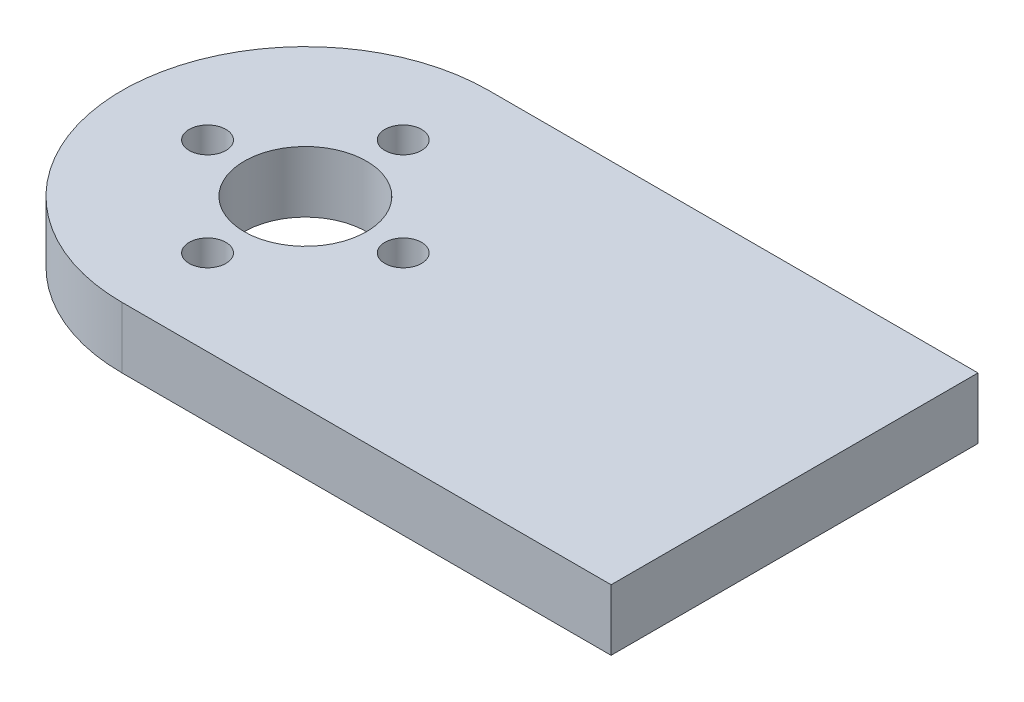
from build123d import *

# Parameters (mm, degrees)
BOSS_EXTRUDE1_DEPTH = 5


with BuildPart() as part:
    # Sketch1 → Boss-Extrude1 (new body)
    with BuildSketch(Plane(origin=(0, 0, 0), x_dir=(1, 0, 0), z_dir=(0, 1, 0))):
        with BuildLine():
            ThreePointArc((-7.859375, 1.493393655), (-5.656854249, 5.656854249), (-1.493393655, 7.859375))
            ThreePointArc((-1.493393655, 7.859375), (-1.109264959, 9.009718401), (0, 9.5))
            Line((0, 9.5), (0, 15))
            ThreePointArc((0, 15), (-15, 0), (0, -15))
            Line((0, -15), (0, -9.5))
            ThreePointArc((0, -9.5), (-1.109264959, -9.009718401), (-1.493393655, -7.859375))
            ThreePointArc((-1.493393655, -7.859375), (-5.656854249, -5.656854249), (-7.859375, -1.493393655))
            ThreePointArc((-7.859375, -1.493393655), (-9.5, 0), (-7.859375, 1.493393655))
        make_face()
        with BuildLine():
            ThreePointArc((1.5, 8), (1.498347504, 7.929609954), (1.493393655, 7.859375))
            ThreePointArc((1.493393655, 7.859375), (5.656854249, 5.656854249), (7.859375, 1.493393655))
            ThreePointArc((7.859375, 1.493393655), (9.009718401, 1.109264959), (9.5, 0))
            ThreePointArc((9.5, 0), (9.009718401, -1.109264959), (7.859375, -1.493393655))
            ThreePointArc((7.859375, -1.493393655), (5.656854249, -5.656854249), (1.493393655, -7.859375))
            ThreePointArc((1.493393655, -7.859375), (1.498347504, -7.929609954), (1.5, -8))
            ThreePointArc((1.5, -8), (1.060660172, -9.060660172), (0, -9.5))
            Line((0, -9.5), (0, -15))
            ThreePointArc((0, -15), (10.606601718, -10.606601718), (15, 0))
            ThreePointArc((15, 0), (10.606601718, 10.606601718), (0, 15))
            Line((0, 15), (0, 9.5))
            ThreePointArc((0, 9.5), (1.060660172, 9.060660172), (1.5, 8))
        make_face()
        with BuildLine():
            ThreePointArc((0, -5), (-5, 0), (0, 5))
            Line((0, 5), (0, 6.5))
            ThreePointArc((0, 6.5), (-1.009718401, 6.890735041), (-1.493393655, 7.859375))
            ThreePointArc((-1.493393655, 7.859375), (-5.656854249, 5.656854249), (-7.859375, 1.493393655))
            ThreePointArc((-7.859375, 1.493393655), (-6.890735041, 1.009718401), (-6.5, 0))
            ThreePointArc((-6.5, 0), (-6.890735041, -1.009718401), (-7.859375, -1.493393655))
            ThreePointArc((-7.859375, -1.493393655), (-5.656854249, -5.656854249), (-1.493393655, -7.859375))
            ThreePointArc((-1.493393655, -7.859375), (-1.009718401, -6.890735041), (0, -6.5))
            Line((0, -6.5), (0, -5))
        make_face()
        with BuildLine():
            Line((0, 6.5), (0, 5))
            ThreePointArc((0, 5), (3.535533906, 3.535533906), (5, 0))
            ThreePointArc((5, 0), (3.535533906, -3.535533906), (0, -5))
            Line((0, -5), (0, -6.5))
            ThreePointArc((0, -6.5), (1.009718401, -6.890735041), (1.493393655, -7.859375))
            ThreePointArc((1.493393655, -7.859375), (5.656854249, -5.656854249), (7.859375, -1.493393655))
            ThreePointArc((7.859375, -1.493393655), (6.5, 0), (7.859375, 1.493393655))
            ThreePointArc((7.859375, 1.493393655), (5.656854249, 5.656854249), (1.493393655, 7.859375))
            ThreePointArc((1.493393655, 7.859375), (1.009718401, 6.890735041), (0, 6.5))
        make_face()
        with BuildLine():
            Line((40, 15), (0, 15))
            ThreePointArc((0, 15), (10.606601718, 10.606601718), (15, 0))
            ThreePointArc((15, 0), (10.606601718, -10.606601718), (0, -15))
            Line((0, -15), (40, -15))
            Line((40, -15), (40, 15))
        make_face()
    extrude(amount=BOSS_EXTRUDE1_DEPTH)


solid = part.part
